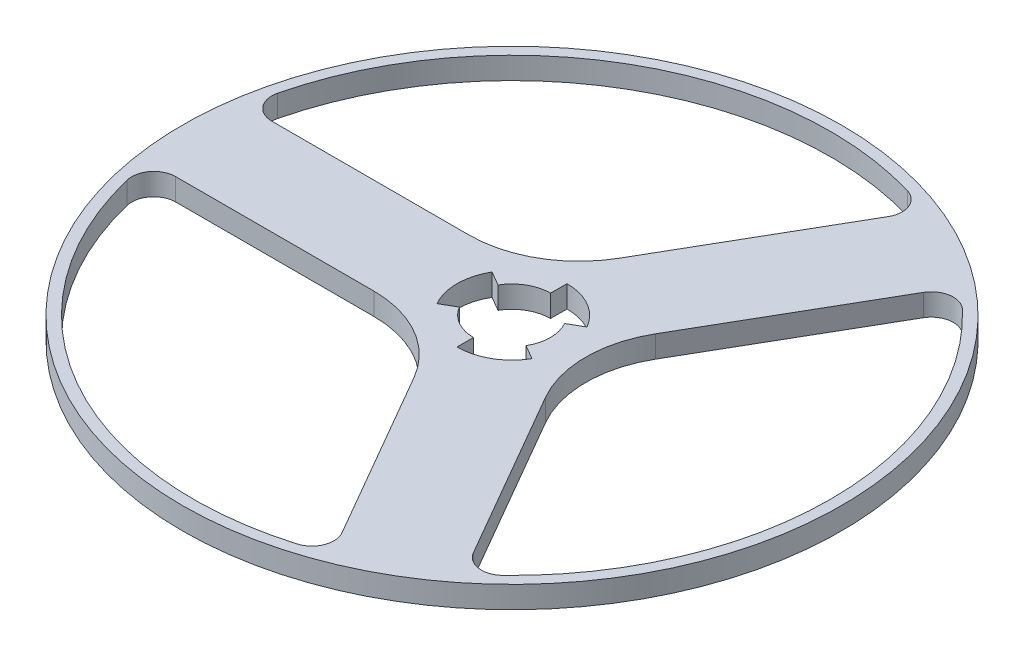
from build123d import *

# Parameters (mm, degrees)
SKETCH1_R           = 46.5
SKETCH1_R_2         = 6.5
SKETCH1_R_3         = 10
SKETCH1_R_4         = 3.5
BOSS_EXTRUDE1_DEPTH = 2
SKETCH3_R           = 5
SKETCH3_R_2         = 3.5
BOSS_EXTRUDE2_DEPTH = 100
SKETCH4_R           = 30
SKETCH4_R_2         = 29
BOSS_EXTRUDE5_DEPTH = 2
FILLET2_R           = 2
SKETCH5_R           = 1
SKETCH5_R_2         = 3.5
CUT_EXTRUDE1_DEPTH  = 1
SKETCH6_R           = 2
CUT_EXTRUDE2_DEPTH  = 2
CHAMFER2_SIZE       = 0.8
SKETCH7_R           = 61.085714235
CUT_EXTRUDE3_DEPTH  = 122.361031637


with BuildPart() as part:
    # Sketch1 → Boss-Extrude1 (new body)
    with BuildSketch(Plane(origin=(0, 0, 0), x_dir=(1, 0, 0), z_dir=(0, 1, 0))):
        with Locations(Location((0, 0, 0), (0, 0, 270))):
            Circle(SKETCH1_R)
        with Locations(Location((0, 15, 0), (0, 0, 270))):
            Circle(SKETCH1_R_2, mode=Mode.SUBTRACT)
        with Locations(Location((-12.990381057, -7.5, 0), (0, 0, 270))):
            Circle(SKETCH1_R_3, mode=Mode.SUBTRACT)
        with Locations(Location((12.990381057, -7.5, 0), (0, 0, 270))):
            Circle(SKETCH1_R_4, mode=Mode.SUBTRACT)
        with Locations(Location((0, 0, 0), (0, 0, 270))):
            Circle(SKETCH1_R_4, mode=Mode.SUBTRACT)
    extrude(amount=BOSS_EXTRUDE1_DEPTH)

    # Sketch3 → Boss-Extrude2 (add)
    with BuildSketch(Plane(origin=(0, 2, 0), x_dir=(1, 0, 0), z_dir=(0, 1, 0))):
        with Locations(Location((0, 0, 0), (0, 0, 210))):
            Circle(SKETCH3_R)
        with Locations(Location((0, 0, 0), (0, 0, 270))):
            Circle(SKETCH3_R_2, mode=Mode.SUBTRACT)
    extrude(amount=BOSS_EXTRUDE2_DEPTH)

    # Sketch6 → Cut-Extrude2 (cut)
    with BuildSketch(Plane.XZ):
        with Locations(Location((0, 35, 0), (0, 0, 270))):
            Circle(SKETCH6_R)
        with Locations(Location((27.364101886, 21.822143065, 0), (0, 0, 270))):
            Circle(SKETCH6_R)
        with Locations(Location((34.122476926, -7.788232688, 0), (0, 0, 270))):
            Circle(SKETCH6_R)
        with Locations(Location((15.185930869, -31.533910377, 0), (0, 0, 270))):
            Circle(SKETCH6_R)
        with Locations(Location((-15.185930869, -31.533910377, 0), (0, 0, 270))):
            Circle(SKETCH6_R)
        with Locations(Location((-34.122476926, -7.788232688, 0), (0, 0, 270))):
            Circle(SKETCH6_R)
        with Locations(Location((-27.364101886, 21.822143065, 0), (0, 0, 270))):
            Circle(SKETCH6_R)
    extrude(amount=-CUT_EXTRUDE2_DEPTH, mode=Mode.SUBTRACT)

    # Chamfer2
    chamfer2_edges = [part.edges().sort_by_distance(p)[0] for p in [
        (12.990381057, 0, 4),
        (34.122476926, 0, -5.788232688),
        (27.364101886, 0, 23.822143065),
        (0, 0, 37),
        (-27.364101886, 0, 23.822143065),
        (-34.122476926, 0, -5.788232688),
        (-15.185930869, 0, -29.533910377),
        (15.185930869, 0, -29.533910377),
    ]]
    chamfer(chamfer2_edges, length=CHAMFER2_SIZE)

    # Sketch7 → Cut-Extrude3 (cut, through all)
    with BuildSketch(Plane.XZ.offset(-102)):
        Circle(SKETCH7_R)
    extrude(amount=CUT_EXTRUDE3_DEPTH, mode=Mode.SUBTRACT)


with BuildPart() as body_2:
    # Sketch4 → Boss-Extrude5 (new body)
    # profile 1 of 11: a face of its own
    with BuildSketch(Plane(origin=(0, 102, 0), x_dir=(1, 0, 0), z_dir=(0, 1, 0))):
        with Locations(Location((0, 0, 0), (0, 0, 270))):
            Circle(SKETCH4_R)
        Circle(SKETCH4_R_2, mode=Mode.SUBTRACT)
    # profile 2 of 11: a face of its own
    with BuildSketch(Plane(origin=(0, 102, 0), x_dir=(1, 0, 0), z_dir=(0, 1, 0))):
        with BuildLine():
            ThreePointArc((0.372035902, 9.373321886), (-3.288218135, 5.713067848), (-8.288218135, 4.373321886))
            Line((-8.288218135, 4.373321886), (-28.668345883, 4.373321886))
            ThreePointArc((-28.668345883, 4.373321886), (-29, 0), (-28.668345883, -4.373321886))
            Line((-28.668345883, -4.373321886), (-8.209333805, -4.373321886))
            ThreePointArc((-8.209333805, -4.373321886), (-3.209333805, -5.713067848), (0.450920232, -9.373321886))
            Line((0.450920232, -9.373321886), (10.619428606, -26.985695027))
            ThreePointArc((10.619428606, -26.985695027), (14.567551204, -25.075614687), (18.182472179, -22.591983212))
            Line((18.182472179, -22.591983212), (7.986293771, -4.931684166))
            ThreePointArc((7.986293771, -4.931684166), (6.646547809, 0.068315834), (7.986293771, 5.068315834))
            Line((7.986293771, 5.068315834), (18.128572143, 22.635257278))
            ThreePointArc((18.128572143, 22.635257278), (14.507755353, 25.110257558), (10.555107028, 27.010918452))
            Line((10.555107028, 27.010918452), (0.372035902, 9.373321886))
        make_face()
        with BuildLine():
            ThreePointArc((-4.421197961, -2.542244793), (-5.099992146, 0.008950407), (-4.412247554, 2.557747353))
            ThreePointArc((-4.412247554, 2.557747353), (-2.542244793, 4.421197961), (0.008950407, 5.099992146))
            ThreePointArc((0.008950407, 5.099992146), (2.557747353, 4.412247554), (4.421197961, 2.542244793))
            ThreePointArc((4.421197961, 2.542244793), (4.927378086, 1.315653905), (5.1, 0))
            ThreePointArc((5.1, 0), (4.925061549, -1.324299338), (4.412247554, -2.557747353))
            ThreePointArc((4.412247554, -2.557747353), (2.542244793, -4.421197961), (-0.008950407, -5.099992146))
            ThreePointArc((-0.008950407, -5.099992146), (-2.557747353, -4.412247554), (-4.421197961, -2.542244793))
        make_face(mode=Mode.SUBTRACT)
    # profile 3 of 11: a face of its own
    with BuildSketch(Plane(origin=(0, 102, 0), x_dir=(1, 0, 0), z_dir=(0, 1, 0))):
        with BuildLine():
            Line((-0.008950407, -5.099992146), (-0.008774909, -4.9999923))
            ThreePointArc((-0.008774909, -4.9999923), (-2.507595444, -4.325732896), (-4.334507805, -2.492396856))
            Line((-4.334507805, -2.492396856), (-4.421197961, -2.542244793))
            ThreePointArc((-4.421197961, -2.542244793), (-2.557747353, -4.412247554), (-0.008950407, -5.099992146))
        make_face()
    # profile 4 of 11: a face of its own
    with BuildSketch(Plane(origin=(0, 102, 0), x_dir=(1, 0, 0), z_dir=(0, 1, 0))):
        with BuildLine():
            Line((-4.412247554, 2.557747353), (-4.325732896, 2.507595444))
            ThreePointArc((-4.325732896, 2.507595444), (-2.492396856, 4.334507805), (0.008774909, 4.9999923))
            Line((0.008774909, 4.9999923), (0.008950407, 5.099992146))
            ThreePointArc((0.008950407, 5.099992146), (-2.542244793, 4.421197961), (-4.412247554, 2.557747353))
        make_face()
    # profile 5 of 11: a face of its own
    with BuildSketch(Plane(origin=(0, 102, 0), x_dir=(1, 0, 0), z_dir=(0, 1, 0))):
        with BuildLine():
            Line((4.421197961, 2.542244793), (4.334507805, 2.492396856))
            ThreePointArc((4.334507805, 2.492396856), (4.830762829, 1.28985677), (5, 0))
            ThreePointArc((5, 0), (4.828491715, -1.298332685), (4.325732896, -2.507595444))
            Line((4.325732896, -2.507595444), (4.412247554, -2.557747353))
            ThreePointArc((4.412247554, -2.557747353), (4.925061549, -1.324299338), (5.1, 0))
            ThreePointArc((5.1, 0), (4.927378086, 1.315653905), (4.421197961, 2.542244793))
        make_face()
    # profile 6 of 11: a face of its own
    with BuildSketch(Plane(origin=(0, 102, 0), x_dir=(1, 0, 0), z_dir=(0, 1, 0))):
        with BuildLine():
            ThreePointArc((-4.334507805, -2.492396856), (-4.9999923, 0.008774909), (-4.325732896, 2.507595444))
            Line((-4.325732896, 2.507595444), (-4.412247554, 2.557747353))
            ThreePointArc((-4.412247554, 2.557747353), (-5.099992146, 0.008950407), (-4.421197961, -2.542244793))
            Line((-4.421197961, -2.542244793), (-4.334507805, -2.492396856))
        make_face()
    # profile 7 of 11: a face of its own
    with BuildSketch(Plane(origin=(0, 102, 0), x_dir=(1, 0, 0), z_dir=(0, 1, 0))):
        with BuildLine():
            Line((4.412247554, -2.557747353), (4.325732896, -2.507595444))
            ThreePointArc((4.325732896, -2.507595444), (2.492396856, -4.334507805), (-0.008774909, -4.9999923))
            Line((-0.008774909, -4.9999923), (-0.008950407, -5.099992146))
            ThreePointArc((-0.008950407, -5.099992146), (2.542244793, -4.421197961), (4.412247554, -2.557747353))
        make_face()
    # profile 8 of 11: a face of its own
    with BuildSketch(Plane(origin=(0, 102, 0), x_dir=(1, 0, 0), z_dir=(0, 1, 0))):
        with BuildLine():
            Line((0.008950407, 5.099992146), (0.008774909, 4.9999923))
            ThreePointArc((0.008774909, 4.9999923), (2.507595444, 4.325732896), (4.334507805, 2.492396856))
            Line((4.334507805, 2.492396856), (4.421197961, 2.542244793))
            ThreePointArc((4.421197961, 2.542244793), (2.557747353, 4.412247554), (0.008950407, 5.099992146))
        make_face()
    # profile 9 of 11: a face of its own
    with BuildSketch(Plane(origin=(0, 102, 0), x_dir=(1, 0, 0), z_dir=(0, 1, 0))):
        with BuildLine():
            Line((-4.325732896, 2.507595444), (-3.028013027, 1.755316811))
            ThreePointArc((-3.028013027, 1.755316811), (-1.744677799, 3.034155464), (0.006142436, 3.49999461))
            Line((0.006142436, 3.49999461), (0.008774909, 4.9999923))
            ThreePointArc((0.008774909, 4.9999923), (-2.492396856, 4.334507805), (-4.325732896, 2.507595444))
        make_face()
    # profile 10 of 11: a face of its own
    with BuildSketch(Plane(origin=(0, 102, 0), x_dir=(1, 0, 0), z_dir=(0, 1, 0))):
        with BuildLine():
            Line((-0.008774909, -4.9999923), (-0.006142436, -3.49999461))
            ThreePointArc((-0.006142436, -3.49999461), (-1.755316811, -3.028013027), (-3.034155464, -1.744677799))
            Line((-3.034155464, -1.744677799), (-4.334507805, -2.492396856))
            ThreePointArc((-4.334507805, -2.492396856), (-2.507595444, -4.325732896), (-0.008774909, -4.9999923))
        make_face()
    # profile 11 of 11: a face of its own
    with BuildSketch(Plane(origin=(0, 102, 0), x_dir=(1, 0, 0), z_dir=(0, 1, 0))):
        with BuildLine():
            Line((4.334507805, 2.492396856), (3.034155464, 1.744677799))
            ThreePointArc((3.034155464, 1.744677799), (3.38153398, 0.902899739), (3.5, 0))
            ThreePointArc((3.5, 0), (3.3799442, -0.908832879), (3.028013027, -1.755316811))
            Line((3.028013027, -1.755316811), (4.325732896, -2.507595444))
            ThreePointArc((4.325732896, -2.507595444), (4.828491715, -1.298332685), (5, 0))
            ThreePointArc((5, 0), (4.830762829, 1.28985677), (4.334507805, 2.492396856))
        make_face()
    extrude(amount=BOSS_EXTRUDE5_DEPTH)

    # Fillet2
    fillet2_edges = [body_2.edges().sort_by_distance(p)[0] for p in [
        (10.555107028, 103, -27.010918452),
        (-28.668345883, 103, -4.373321886),
        (18.128572143, 103, -22.635257278),
        (18.182472179, 103, 22.591983212),
        (10.619428606, 103, 26.985695027),
        (-28.668345883, 103, 4.373321886),
    ]]
    fillet(fillet2_edges, radius=FILLET2_R)

    # Sketch5 → Cut-Extrude1 (cut)
    with BuildSketch(Plane.XZ.offset(-102)):
        with Locations(Location((-15, 0, 0), (0, 0, 270))):
            Circle(SKETCH5_R)
        with Locations(Location((7.5, 12.990381057, 0), (0, 0, 270))):
            Circle(SKETCH5_R_2)
        Polygon((8.383974596, -16.52146997), (4.883974596, -10.459292144), (6.616025404, -9.459292144), (10.116025404, -15.52146997), align=None)
    extrude(amount=-CUT_EXTRUDE1_DEPTH, mode=Mode.SUBTRACT)


solid = body_2.part
